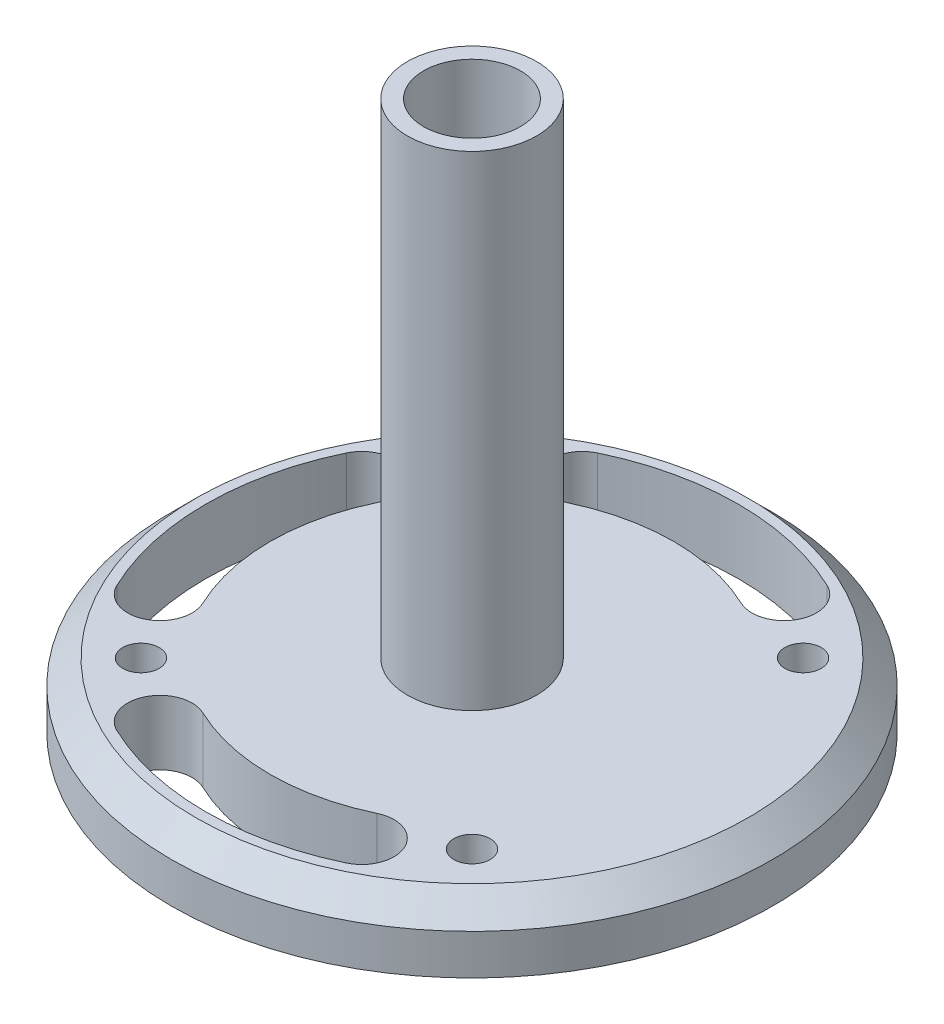
from build123d import *

# Parameters (mm, degrees)
SKETCH1_R           = 37.25
BOSS_EXTRUDE1_DEPTH = 8
SKETCH2_R           = 8
SKETCH2_R_2         = 6
BOSS_EXTRUDE2_DEPTH = 60
CHAMFER1_SIZE       = 3
CUT_EXTRUDE1_START  = -10
SKETCH3_R           = 6
CUT_EXTRUDE1_DEPTH  = 10
SKETCH4_R           = 2.25
CUT_EXTRUDE2_DEPTH  = 10


with BuildPart() as part:
    # Sketch1 → Boss-Extrude1 (new body)
    with BuildSketch(Plane(origin=(0, 0, 0), x_dir=(1, 0, 0), z_dir=(0, 1, 0))):
        with Locations(Location((0, 0, 0), (0, 0, 270))):
            Circle(SKETCH1_R)
    extrude(amount=BOSS_EXTRUDE1_DEPTH)

    # Sketch2 → Boss-Extrude2 (add)
    with BuildSketch(Plane(origin=(0, 8, 0), x_dir=(1, 0, 0), z_dir=(0, 1, 0))):
        with Locations(Location((0, 0, 0), (0, 0, 270))):
            Circle(SKETCH2_R)
        with Locations(Location((0, 0, 0), (0, 0, 270))):
            Circle(SKETCH2_R_2, mode=Mode.SUBTRACT)
    extrude(amount=BOSS_EXTRUDE2_DEPTH)

    # Chamfer1
    chamfer1_edges = [part.edges().sort_by_distance(p)[0] for p in [
        (0, 8, -37.25),
    ]]
    chamfer(chamfer1_edges, length=CHAMFER1_SIZE)

    # Sketch3 → Cut-Extrude1 (cut)
    with BuildSketch(Plane(origin=(0, 8, 0), x_dir=(1, 0, 0), z_dir=(0, 1, 0)).offset(CUT_EXTRUDE1_START)):
        with Locations(Location((0, 0, 0), (0, 0, 270))):
            Circle(SKETCH3_R)
    extrude(amount=CUT_EXTRUDE1_DEPTH, mode=Mode.SUBTRACT)

    # Sketch4 → Cut-Extrude2 (cut)
    with BuildSketch(Plane(origin=(0, 0, 0), x_dir=(-1, 0, 0), z_dir=(0, -1, 0))):
        with Locations(Location((20.506096654, 20.506096654, 0), (0, 0, 90))):
            Circle(SKETCH4_R)
        with Locations(Location((20.506096654, -20.506096654, 0), (0, 0, 90))):
            Circle(SKETCH4_R)
        with Locations(Location((-20.506096654, -20.506096654, 0), (0, 0, 90))):
            Circle(SKETCH4_R)
        with Locations(Location((-20.506096654, 20.506096654, 0), (0, 0, 90))):
            Circle(SKETCH4_R)
        with BuildLine():
            ThreePointArc((29.777070039, -14.224137931), (33, 0), (29.777070039, 14.224137931))
            ThreePointArc((29.777070039, 14.224137931), (24.443590285, 16.109341823), (22.558386393, 10.775862069))
            ThreePointArc((22.558386393, 10.775862069), (25, 0), (22.558386393, -10.775862069))
            ThreePointArc((22.558386393, -10.775862069), (24.443590285, -16.109341823), (29.777070039, -14.224137931))
        make_face()
        with BuildLine():
            ThreePointArc((-14.224137931, -29.777070039), (0, -33), (14.224137931, -29.777070039))
            ThreePointArc((14.224137931, -29.777070039), (16.109341823, -24.443590285), (10.775862069, -22.558386393))
            ThreePointArc((10.775862069, -22.558386393), (0, -25), (-10.775862069, -22.558386393))
            ThreePointArc((-10.775862069, -22.558386393), (-16.109341823, -24.443590285), (-14.224137931, -29.777070039))
        make_face()
        with BuildLine():
            ThreePointArc((14.224137931, 29.777070039), (0, 33), (-14.224137931, 29.777070039))
            ThreePointArc((-14.224137931, 29.777070039), (-16.109341823, 24.443590285), (-10.775862069, 22.558386393))
            ThreePointArc((-10.775862069, 22.558386393), (0, 25), (10.775862069, 22.558386393))
            ThreePointArc((10.775862069, 22.558386393), (16.109341823, 24.443590285), (14.224137931, 29.777070039))
        make_face()
    extrude(amount=-CUT_EXTRUDE2_DEPTH, mode=Mode.SUBTRACT)


solid = part.part
